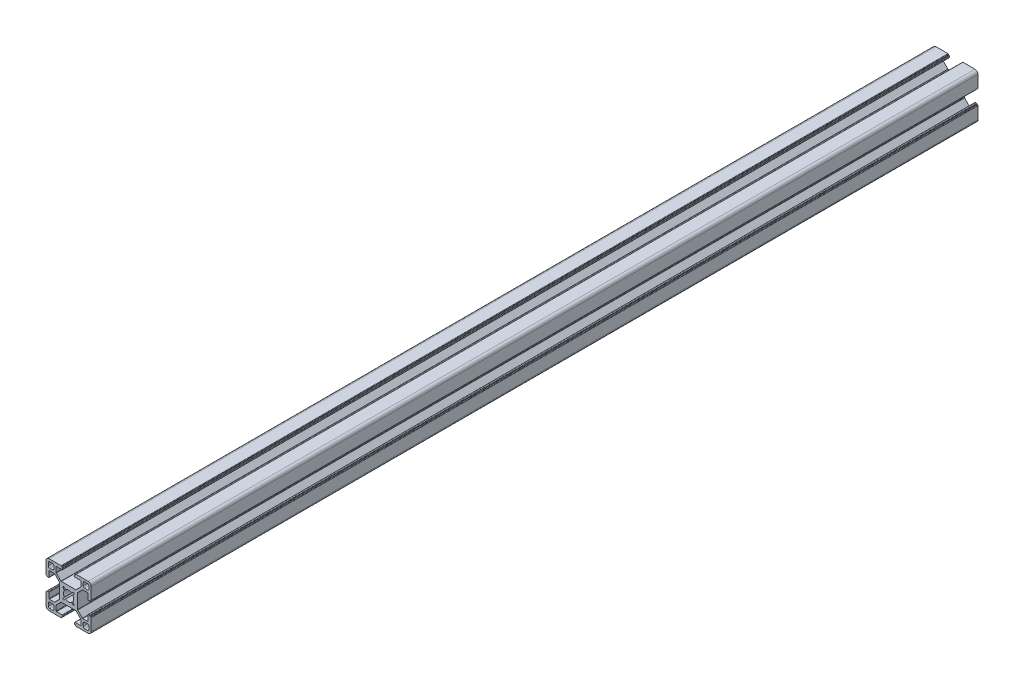
from build123d import *

# Parameters (mm, degrees)
ESTRUSIONE_ESTRUSIONE1_DEPTH = 590


with BuildPart() as part:
    # Schizzo1 → Estrusione-Estrusione1 (new body)
    with BuildSketch(Plane.XY.offset(25)):
        with BuildLine():
            Line((-4.7, -14.7), (-4.7, -14.6))
            ThreePointArc((-4.7, -14.6), (-4.612132034, -14.387867966), (-4.4, -14.3))
            Line((-4.4, -14.3), (-4.3, -14.3))
            ThreePointArc((-4.3, -14.3), (-4.087867966, -14.212132034), (-4, -14))
            Line((-4, -14), (-4, -13.3))
            ThreePointArc((-4, -13.3), (-4.087867966, -13.087867966), (-4.3, -13))
            Line((-4.3, -13), (-7.95, -13))
            ThreePointArc((-7.95, -13), (-8.162132034, -12.912132034), (-8.25, -12.7))
            Line((-8.25, -12.7), (-8.25, -9.43492424))
            ThreePointArc((-8.25, -9.43492424), (-8.22716386, -9.320119211), (-8.162132034, -9.222792206))
            Line((-8.162132034, -9.222792206), (-5.027207794, -6.087867966))
            ThreePointArc((-5.027207794, -6.087867966), (-4.929880789, -6.02283614), (-4.81507576, -6))
            Line((-4.81507576, -6), (4.81507576, -6))
            ThreePointArc((4.81507576, -6), (4.929880789, -6.02283614), (5.027207794, -6.087867966))
            Line((5.027207794, -6.087867966), (8.162132034, -9.222792206))
            ThreePointArc((8.162132034, -9.222792206), (8.22716386, -9.320119211), (8.25, -9.43492424))
            Line((8.25, -9.43492424), (8.25, -12.7))
            ThreePointArc((8.25, -12.7), (8.162132034, -12.912132034), (7.95, -13))
            Line((7.95, -13), (4.3, -13))
            ThreePointArc((4.3, -13), (4.087867966, -13.087867966), (4, -13.3))
            Line((4, -13.3), (4, -14))
            ThreePointArc((4, -14), (4.087867966, -14.212132034), (4.3, -14.3))
            Line((4.3, -14.3), (4.4, -14.3))
            ThreePointArc((4.4, -14.3), (4.612132034, -14.387867966), (4.7, -14.6))
            Line((4.7, -14.6), (4.7, -14.7))
            ThreePointArc((4.7, -14.7), (4.787867966, -14.912132034), (5, -15))
            Line((5, -15), (13, -15))
            ThreePointArc((13, -15), (14.414213562, -14.414213562), (15, -13))
            Line((15, -13), (15, -5))
            ThreePointArc((15, -5), (14.912132034, -4.787867966), (14.7, -4.7))
            Line((14.7, -4.7), (14.6, -4.7))
            ThreePointArc((14.6, -4.7), (14.387867966, -4.612132034), (14.3, -4.4))
            Line((14.3, -4.4), (14.3, -4.3))
            ThreePointArc((14.3, -4.3), (14.212132034, -4.087867966), (14, -4))
            Line((14, -4), (13.3, -4))
            ThreePointArc((13.3, -4), (13.087867966, -4.087867966), (13, -4.3))
            Line((13, -4.3), (13, -7.95))
            ThreePointArc((13, -7.95), (12.912132034, -8.162132034), (12.7, -8.25))
            Line((12.7, -8.25), (9.43492424, -8.25))
            ThreePointArc((9.43492424, -8.25), (9.320119211, -8.22716386), (9.222792206, -8.162132034))
            Line((9.222792206, -8.162132034), (6.087867966, -5.027207794))
            ThreePointArc((6.087867966, -5.027207794), (6.02283614, -4.929880789), (6, -4.81507576))
            Line((6, -4.81507576), (6, 4.81507576))
            ThreePointArc((6, 4.81507576), (6.02283614, 4.929880789), (6.087867966, 5.027207794))
            Line((6.087867966, 5.027207794), (9.222792206, 8.162132034))
            ThreePointArc((9.222792206, 8.162132034), (9.320119211, 8.22716386), (9.43492424, 8.25))
            Line((9.43492424, 8.25), (12.7, 8.25))
            ThreePointArc((12.7, 8.25), (12.912132034, 8.162132034), (13, 7.95))
            Line((13, 7.95), (13, 4.3))
            ThreePointArc((13, 4.3), (13.087867966, 4.087867966), (13.3, 4))
            Line((13.3, 4), (14, 4))
            ThreePointArc((14, 4), (14.212132034, 4.087867966), (14.3, 4.3))
            Line((14.3, 4.3), (14.3, 4.4))
            ThreePointArc((14.3, 4.4), (14.387867966, 4.612132034), (14.6, 4.7))
            Line((14.6, 4.7), (14.7, 4.7))
            ThreePointArc((14.7, 4.7), (14.912132034, 4.787867966), (15, 5))
            Line((15, 5), (15, 13))
            ThreePointArc((15, 13), (14.414213562, 14.414213562), (13, 15))
            Line((13, 15), (5, 15))
            ThreePointArc((5, 15), (4.787867966, 14.912132034), (4.7, 14.7))
            Line((4.7, 14.7), (4.7, 14.6))
            ThreePointArc((4.7, 14.6), (4.612132034, 14.387867966), (4.4, 14.3))
            Line((4.4, 14.3), (4.3, 14.3))
            ThreePointArc((4.3, 14.3), (4.087867966, 14.212132034), (4, 14))
            Line((4, 14), (4, 13.3))
            ThreePointArc((4, 13.3), (4.087867966, 13.087867966), (4.3, 13))
            Line((4.3, 13), (7.95, 13))
            ThreePointArc((7.95, 13), (8.162132034, 12.912132034), (8.25, 12.7))
            Line((8.25, 12.7), (8.25, 9.43492424))
            ThreePointArc((8.25, 9.43492424), (8.22716386, 9.320119211), (8.162132034, 9.222792206))
            Line((8.162132034, 9.222792206), (5.027207794, 6.087867966))
            ThreePointArc((5.027207794, 6.087867966), (4.929880789, 6.02283614), (4.81507576, 6))
            Line((4.81507576, 6), (-4.81507576, 6))
            ThreePointArc((-4.81507576, 6), (-4.929880789, 6.02283614), (-5.027207794, 6.087867966))
            Line((-5.027207794, 6.087867966), (-8.162132034, 9.222792206))
            ThreePointArc((-8.162132034, 9.222792206), (-8.22716386, 9.320119211), (-8.25, 9.43492424))
            Line((-8.25, 9.43492424), (-8.25, 12.7))
            ThreePointArc((-8.25, 12.7), (-8.162132034, 12.912132034), (-7.95, 13))
            Line((-7.95, 13), (-4.3, 13))
            ThreePointArc((-4.3, 13), (-4.087867966, 13.087867966), (-4, 13.3))
            Line((-4, 13.3), (-4, 14))
            ThreePointArc((-4, 14), (-4.087867966, 14.212132034), (-4.3, 14.3))
            Line((-4.3, 14.3), (-4.4, 14.3))
            ThreePointArc((-4.4, 14.3), (-4.612132034, 14.387867966), (-4.7, 14.6))
            Line((-4.7, 14.6), (-4.7, 14.7))
            ThreePointArc((-4.7, 14.7), (-4.787867966, 14.912132034), (-5, 15))
            Line((-5, 15), (-13, 15))
            ThreePointArc((-13, 15), (-14.414213562, 14.414213562), (-15, 13))
            Line((-15, 13), (-15, 5))
            ThreePointArc((-15, 5), (-14.912132034, 4.787867966), (-14.7, 4.7))
            Line((-14.7, 4.7), (-14.6, 4.7))
            ThreePointArc((-14.6, 4.7), (-14.387867966, 4.612132034), (-14.3, 4.4))
            Line((-14.3, 4.4), (-14.3, 4.3))
            ThreePointArc((-14.3, 4.3), (-14.212132034, 4.087867966), (-14, 4))
            Line((-14, 4), (-13.3, 4))
            ThreePointArc((-13.3, 4), (-13.087867966, 4.087867966), (-13, 4.3))
            Line((-13, 4.3), (-13, 7.95))
            ThreePointArc((-13, 7.95), (-12.912132034, 8.162132034), (-12.7, 8.25))
            Line((-12.7, 8.25), (-9.43492424, 8.25))
            ThreePointArc((-9.43492424, 8.25), (-9.320119211, 8.22716386), (-9.222792206, 8.162132034))
            Line((-9.222792206, 8.162132034), (-6.087867966, 5.027207794))
            ThreePointArc((-6.087867966, 5.027207794), (-6.02283614, 4.929880789), (-6, 4.81507576))
            Line((-6, 4.81507576), (-6, -4.81507576))
            ThreePointArc((-6, -4.81507576), (-6.02283614, -4.929880789), (-6.087867966, -5.027207794))
            Line((-6.087867966, -5.027207794), (-9.222792206, -8.162132034))
            ThreePointArc((-9.222792206, -8.162132034), (-9.320119211, -8.22716386), (-9.43492424, -8.25))
            Line((-9.43492424, -8.25), (-12.7, -8.25))
            ThreePointArc((-12.7, -8.25), (-12.912132034, -8.162132034), (-13, -7.95))
            Line((-13, -7.95), (-13, -4.3))
            ThreePointArc((-13, -4.3), (-13.087867966, -4.087867966), (-13.3, -4))
            Line((-13.3, -4), (-14, -4))
            ThreePointArc((-14, -4), (-14.212132034, -4.087867966), (-14.3, -4.3))
            Line((-14.3, -4.3), (-14.3, -4.4))
            ThreePointArc((-14.3, -4.4), (-14.387867966, -4.612132034), (-14.6, -4.7))
            Line((-14.6, -4.7), (-14.7, -4.7))
            ThreePointArc((-14.7, -4.7), (-14.912132034, -4.787867966), (-15, -5))
            Line((-15, -5), (-15, -13))
            ThreePointArc((-15, -13), (-14.414213562, -14.414213562), (-13, -15))
            Line((-13, -15), (-5, -15))
            ThreePointArc((-5, -15), (-4.787867966, -14.912132034), (-4.7, -14.7))
        make_face()
        with BuildLine():
            Line((-12.5625, -9.75), (-10.6875, -9.75))
            ThreePointArc((-10.6875, -9.75), (-10.024587393, -10.024587393), (-9.75, -10.6875))
            Line((-9.75, -10.6875), (-9.75, -12.5625))
            ThreePointArc((-9.75, -12.5625), (-10.024587393, -13.225412607), (-10.6875, -13.5))
            Line((-10.6875, -13.5), (-12.5625, -13.5))
            ThreePointArc((-12.5625, -13.5), (-13.225412607, -13.225412607), (-13.5, -12.5625))
            Line((-13.5, -12.5625), (-13.5, -10.6875))
            ThreePointArc((-13.5, -10.6875), (-13.225412607, -10.024587393), (-12.5625, -9.75))
        make_face(mode=Mode.SUBTRACT)
        with BuildLine():
            Line((12.5625, 9.75), (10.6875, 9.75))
            ThreePointArc((10.6875, 9.75), (10.024587393, 10.024587393), (9.75, 10.6875))
            Line((9.75, 10.6875), (9.75, 12.5625))
            ThreePointArc((9.75, 12.5625), (10.024587393, 13.225412607), (10.6875, 13.5))
            Line((10.6875, 13.5), (12.5625, 13.5))
            ThreePointArc((12.5625, 13.5), (13.225412607, 13.225412607), (13.5, 12.5625))
            Line((13.5, 12.5625), (13.5, 10.6875))
            ThreePointArc((13.5, 10.6875), (13.225412607, 10.024587393), (12.5625, 9.75))
        make_face(mode=Mode.SUBTRACT)
        with BuildLine():
            Line((2.010111251, 2.742162059), (2.867949192, 3.6))
            ThreePointArc((2.867949192, 3.6), (3.6, 3.6), (3.6, 2.867949192))
            Line((3.6, 2.867949192), (2.742162059, 2.010111251))
            ThreePointArc((2.742162059, 2.010111251), (3.4, 0), (2.742162059, -2.010111251))
            Line((2.742162059, -2.010111251), (3.6, -2.867949192))
            ThreePointArc((3.6, -2.867949192), (3.6, -3.6), (2.867949192, -3.6))
            Line((2.867949192, -3.6), (2.010111251, -2.742162059))
            ThreePointArc((2.010111251, -2.742162059), (0, -3.4), (-2.010111251, -2.742162059))
            Line((-2.010111251, -2.742162059), (-2.867949192, -3.6))
            ThreePointArc((-2.867949192, -3.6), (-3.6, -3.6), (-3.6, -2.867949192))
            Line((-3.6, -2.867949192), (-2.742162059, -2.010111251))
            ThreePointArc((-2.742162059, -2.010111251), (-3.4, 0), (-2.742162059, 2.010111251))
            Line((-2.742162059, 2.010111251), (-3.6, 2.867949192))
            ThreePointArc((-3.6, 2.867949192), (-3.6, 3.6), (-2.867949192, 3.6))
            Line((-2.867949192, 3.6), (-2.010111251, 2.742162059))
            ThreePointArc((-2.010111251, 2.742162059), (0, 3.4), (2.010111251, 2.742162059))
        make_face(mode=Mode.SUBTRACT)
        with BuildLine():
            Line((-9.75, 12.5625), (-9.75, 10.6875))
            ThreePointArc((-9.75, 10.6875), (-10.024587393, 10.024587393), (-10.6875, 9.75))
            Line((-10.6875, 9.75), (-12.5625, 9.75))
            ThreePointArc((-12.5625, 9.75), (-13.225412607, 10.024587393), (-13.5, 10.6875))
            Line((-13.5, 10.6875), (-13.5, 12.5625))
            ThreePointArc((-13.5, 12.5625), (-13.225412607, 13.225412607), (-12.5625, 13.5))
            Line((-12.5625, 13.5), (-10.6875, 13.5))
            ThreePointArc((-10.6875, 13.5), (-10.024587393, 13.225412607), (-9.75, 12.5625))
        make_face(mode=Mode.SUBTRACT)
        with BuildLine():
            Line((9.75, -12.5625), (9.75, -10.6875))
            ThreePointArc((9.75, -10.6875), (10.024587393, -10.024587393), (10.6875, -9.75))
            Line((10.6875, -9.75), (12.5625, -9.75))
            ThreePointArc((12.5625, -9.75), (13.225412607, -10.024587393), (13.5, -10.6875))
            Line((13.5, -10.6875), (13.5, -12.5625))
            ThreePointArc((13.5, -12.5625), (13.225412607, -13.225412607), (12.5625, -13.5))
            Line((12.5625, -13.5), (10.6875, -13.5))
            ThreePointArc((10.6875, -13.5), (10.024587393, -13.225412607), (9.75, -12.5625))
        make_face(mode=Mode.SUBTRACT)
    extrude(amount=-ESTRUSIONE_ESTRUSIONE1_DEPTH)


solid = part.part
